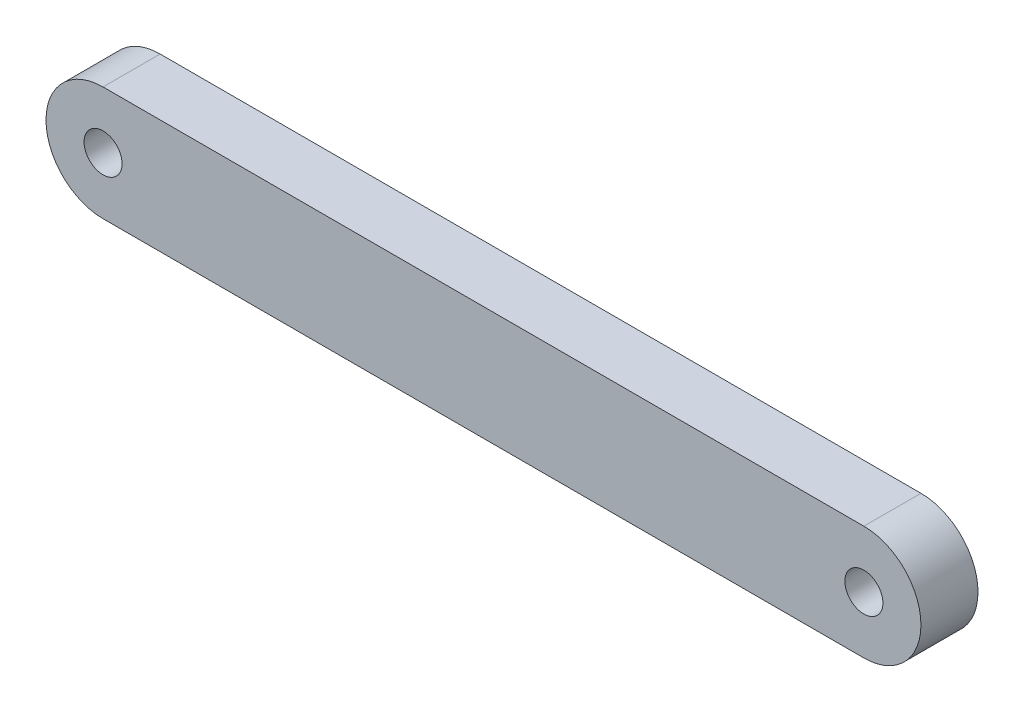
from build123d import *

# Parameters (mm, degrees)
SKETCH1_R           = 1
BOSS_EXTRUDE1_DEPTH = 3


with BuildPart() as part:
    # Sketch1 → Boss-Extrude1 (new body)
    with BuildSketch(Plane.XY):
        with BuildLine():
            Line((20, -3), (-20, -3))
            ThreePointArc((-20, -3), (-23, 0), (-20, 3))
            Line((-20, 3), (20, 3))
            ThreePointArc((20, 3), (23, 0), (20, -3))
        make_face()
        with Locations((-20, 0)):
            Circle(SKETCH1_R, mode=Mode.SUBTRACT)
        with Locations((20, 0)):
            Circle(SKETCH1_R, mode=Mode.SUBTRACT)
    extrude(amount=BOSS_EXTRUDE1_DEPTH)


solid = part.part
